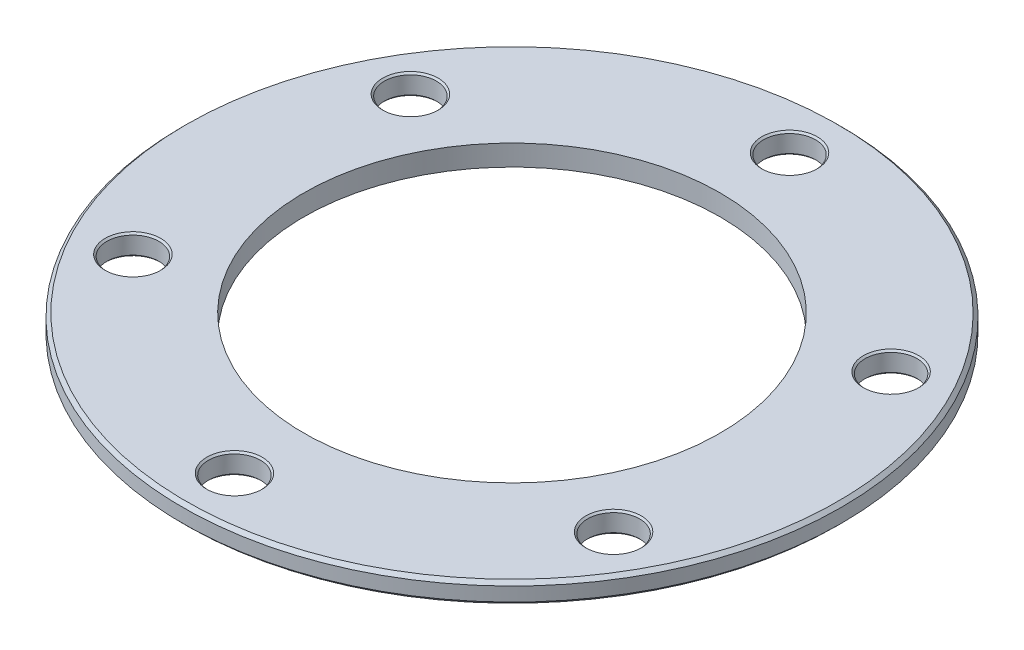
from build123d import *

# Parameters (mm, degrees)
SKETCH1_W                = 95
SKETCH1_H                = 6
HOLE1_D                  = 120
F_9_16_CLEARANCE_HOLE1_D = 15
F_9_16_CLEARANCE_HOLE2_D = 15
CHAMFER1_SIZE            = 0.5
CHAMFER2_SIZE            = 1


with BuildPart() as part:
    # Sketch1 → Revolve1 (revolve)
    with BuildSketch(Plane.XY):
        with Locations((47.5, 2)):
            Rectangle(SKETCH1_W, SKETCH1_H)
    revolve(axis=Axis((0, 5, 0), (0, -1, 0)))

    # Hole1 (through all)
    with Locations(Plane(origin=(0, -1, 0), x_dir=(-1, 0, 0), z_dir=(0, -1, 0))):
        with Locations((0, 0)):
            Hole(HOLE1_D / 2)

    # 9/16 Clearance Hole1 (through all)
    with Locations(Plane(origin=(0, -1, 0), x_dir=(-1, 0, 0), z_dir=(0, -1, 0))):
        with Locations((69.282032303, 40), (0, 80)):
            Hole(F_9_16_CLEARANCE_HOLE1_D / 2)

    # 9/16 Clearance Hole2 (through all)
    with Locations(Plane(origin=(0, 5, 0), x_dir=(1, 0, 0), z_dir=(0, 1, 0))):
        with Locations((-69.282032303, -40), (69.282032303, 40), (69.282032303, -40), (0, -80)):
            Hole(F_9_16_CLEARANCE_HOLE2_D / 2)

    # Chamfer1
    chamfer1_edges = [part.edges().sort_by_distance(p)[0] for p in [
        (-7.5, -1, -80),
        (-7.5, 5, -80),
        (-76.782032303, -1, -40),
        (-76.782032303, 5, -40),
        (7.5, 5, 80),
        (7.5, -1, 80),
        (76.782032303, 5, 40),
        (76.782032303, -1, 40),
        (76.782032303, 5, -40),
        (76.782032303, -1, -40),
        (-61.782032303, 5, 40),
        (-61.782032303, -1, 40),
    ]]
    chamfer(chamfer1_edges, length=CHAMFER1_SIZE)

    # Chamfer2
    chamfer2_edges = [part.edges().sort_by_distance(p)[0] for p in [
        (-95, -1, 0),
        (-95, 5, 0),
    ]]
    chamfer(chamfer2_edges, length=CHAMFER2_SIZE)


solid = part.part
